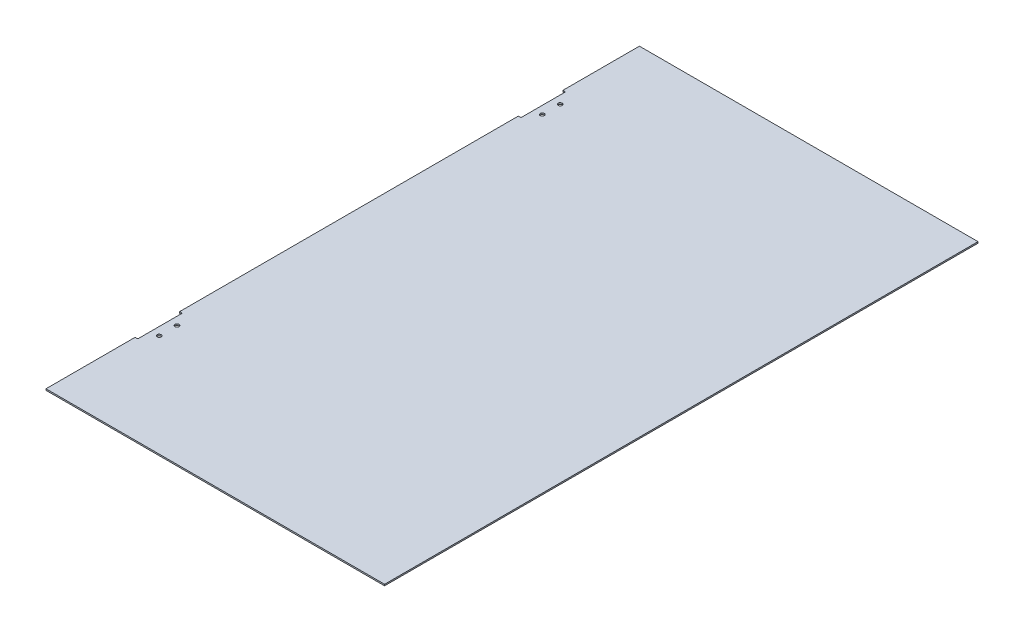
from build123d import *

# Parameters (mm, degrees)
PANEL_DEPTH       = 0.79
SKETCH3_R         = 1.125
HINGE_MOUNT_DEPTH = 0.79


with BuildPart() as part:
    # Sketch1 → Panel (new body)
    with BuildSketch(Plane(origin=(0, 0, 0), x_dir=(1, 0, 0), z_dir=(0, 1, 0))):
        Polygon((65.326251897, 149.069802731), (95.326251897, 149.069802731), (95.326251897, -183.930197269), (-94.673748103, -183.930197269), (-94.673748103, 149.069802731), (-64.673748103, 149.069802731), (-39.673748103, 149.069802731), (40.326251897, 149.069802731), align=None)
    extrude(amount=PANEL_DEPTH)

    # Sketch3 → Hinge Mount (cut)
    with BuildSketch(Plane(origin=(0, 0.79, 0), x_dir=(1, 0, 0), z_dir=(0, 1, 0))):
        with Locations(Location((-88.673748103, -116.430197269, 0), (0, 0, 270))):
            Circle(SKETCH3_R)
        with Locations(Location((-88.673748103, -126.430197269, 0), (0, 0, 270))):
            Circle(SKETCH3_R)
        with BuildLine():
            Line((-94.673748103, -108.930197269), (-93.673748103, -108.930197269))
            ThreePointArc((-93.673748103, -108.930197269), (-93.320194713, -109.076643878), (-93.173748103, -109.430197269))
            Line((-93.173748103, -109.430197269), (-93.173748103, -133.430197269))
            ThreePointArc((-93.173748103, -133.430197269), (-93.320194713, -133.783750659), (-93.673748103, -133.930197269))
            Line((-93.673748103, -133.930197269), (-94.673748103, -133.930197269))
            Line((-94.673748103, -133.930197269), (-94.673748103, -108.930197269))
        make_face()
    hinge_mount = extrude(amount=-HINGE_MOUNT_DEPTH, mode=Mode.SUBTRACT)

    # Mirror1: Hinge Mount across plane
    add(hinge_mount.mirror(Plane.XY.offset(13.930197269)), mode=Mode.SUBTRACT)


solid = part.part
